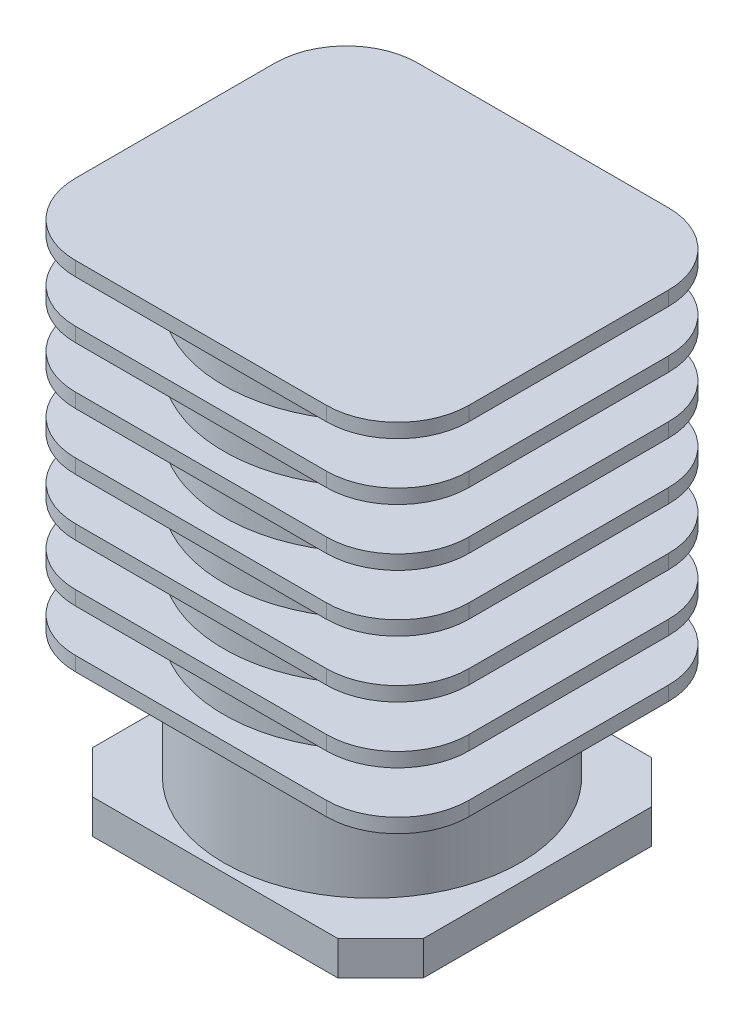
from build123d import *

# Parameters (mm, degrees)
SKETCH1_R           = 52
BOSS_EXTRUDE1_DEPTH = 165
BOSS_EXTRUDE2_DEPTH = 5
LPATTERN1_COUNT     = 7
LPATTERN1_PITCH     = 20
BOSS_EXTRUDE3_DEPTH = 12
SKETCH4_R           = 47
CUT_EXTRUDE1_DEPTH  = 172


with BuildPart() as part:
    # Sketch1 → Boss-Extrude1 (new body)
    with BuildSketch(Plane(origin=(0, 0, 0), x_dir=(1, 0, 0), z_dir=(0, 1, 0))):
        with Locations(Location((0, 0, 0), (0, 0, 270))):
            Circle(SKETCH1_R)
    extrude(amount=-BOSS_EXTRUDE1_DEPTH)

    # Sketch2 → Boss-Extrude2 (add)
    with BuildSketch(Plane(origin=(0, 0, 0), x_dir=(1, 0, 0), z_dir=(0, 1, 0))):
        with BuildLine():
            Line((-44, -60), (44, -60))
            ThreePointArc((44, -60), (61.67766953, -52.67766953), (69, -35))
            Line((69, -35), (69, 35))
            ThreePointArc((69, 35), (61.67766953, 52.67766953), (44, 60))
            Line((44, 60), (-44, 60))
            ThreePointArc((-44, 60), (-61.67766953, 52.67766953), (-69, 35))
            Line((-69, 35), (-69, -35))
            ThreePointArc((-69, -35), (-61.67766953, -52.67766953), (-44, -60))
        make_face()
    boss_extrude2 = extrude(amount=-BOSS_EXTRUDE2_DEPTH)

    # LPattern1: Boss-Extrude2 ×7
    with Locations(*[(0, -i * LPATTERN1_PITCH, 0) for i in range(1, LPATTERN1_COUNT)]):
        add(boss_extrude2)

    # Sketch3 → Boss-Extrude3 (add)
    with BuildSketch(Plane.XZ.offset(165)):
        Polygon((-43, 55), (-58, 40), (-58, -40), (-43, -55), (43, -55), (58, -40), (58, 40), (43, 55), align=None)
    extrude(amount=BOSS_EXTRUDE3_DEPTH)

    # Sketch4 → Cut-Extrude1 (cut)
    with BuildSketch(Plane.XZ.offset(177)):
        with Locations(Location((0, 0, 0), (0, 0, 270))):
            Circle(SKETCH4_R)
    extrude(amount=-CUT_EXTRUDE1_DEPTH, mode=Mode.SUBTRACT)


solid = part.part
